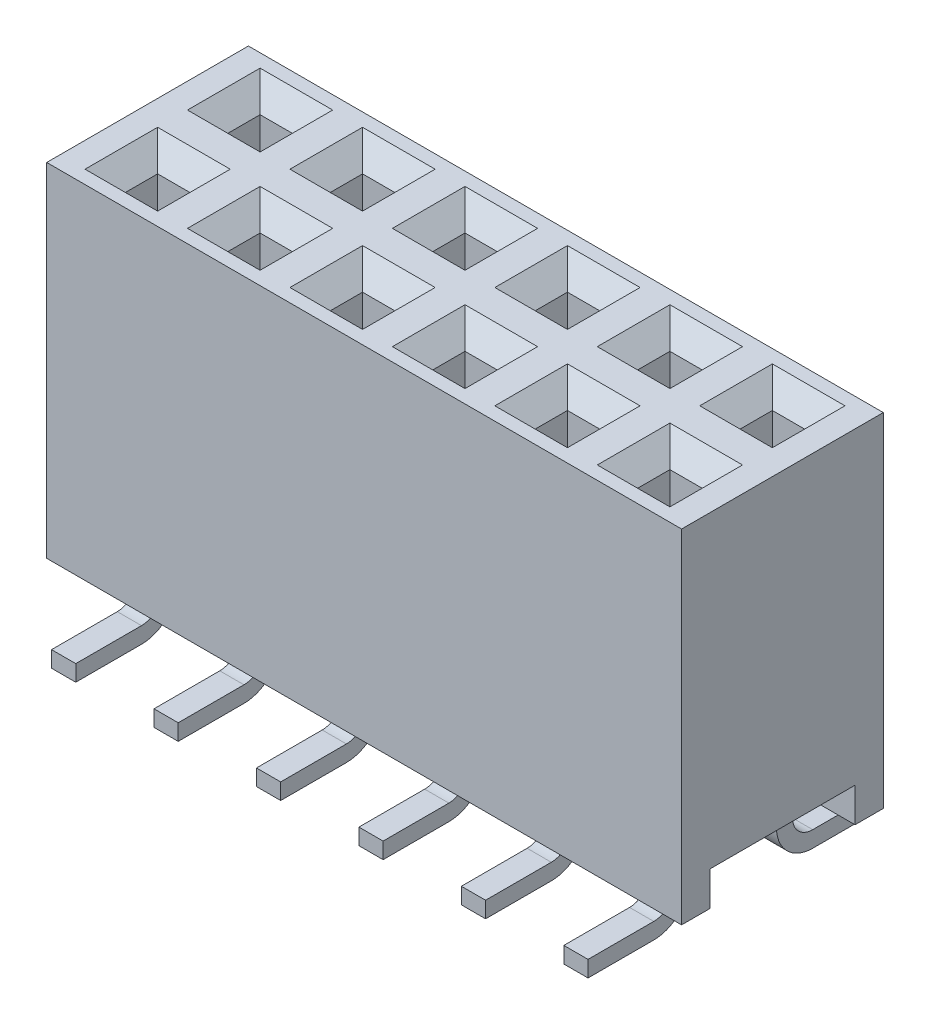
from build123d import *

# Parameters (mm, degrees)
EXTRUDE_1_DEPTH                    = 7.87
SKETCH_2_W                         = 0.8
SKETCH_2_H                         = 0.8
CUT_EXTRUDE_1_DEPTH                = 12.850607579
CHAMFER_1_SIZE                     = 0.5
PATTERN_LINEAR_1_COUNT             = 6
PATTERN_LINEAR_1_PITCH             = 2.54
PATTERN_LINEAR_1_COUNT_DIR2        = 2
PATTERN_LINEAR_1_PITCH_DIR2        = 2.54
CHAMFER_1_OF_PATTERN_LINEAR_1_SIZE = 0.5
EXTRUDE_2_DEPTH                    = 0.3
PATTERN_LINEAR_2_COUNT             = 6
PATTERN_LINEAR_2_PITCH             = 2.54


with BuildPart() as part:
    # Эскиз1 → Бобышка-Вытянуть1 (new, symmetric)
    with BuildSketch(Plane(origin=(0, 0, 0), x_dir=(0, 0, -1), z_dir=(1, 0, 0))):
        Polygon((-2.5, 1.2), (-2.5, 9.7), (2.5, 9.7), (2.5, 1.2), (1.8, 1.2), (1.8, 2.05), (-1.8, 2.05), (-1.8, 1.2), align=None)
    extrude(amount=EXTRUDE_1_DEPTH, both=True)

    # Эскиз2 → Вырез-Вытянуть1 (cut, through all)
    with BuildSketch(Plane(origin=(0, 9.7, 0), x_dir=(1, 0, 0), z_dir=(0, 1, 0))):
        with Locations((6.35, -1.27)):
            Rectangle(SKETCH_2_W, SKETCH_2_H)
    cut_extrude_1 = extrude(amount=-CUT_EXTRUDE_1_DEPTH, mode=Mode.SUBTRACT)

    # Фаска1
    chamfer_1_edges = [part.edges().sort_by_distance(p)[0] for p in [
        (6.75, 9.7, 1.27),
        (6.35, 9.7, 0.87),
        (5.95, 9.7, 1.27),
        (6.35, 9.7, 1.67),
    ]]
    chamfer(chamfer_1_edges, length=CHAMFER_1_SIZE)

    # Линейный массив1: Cut-Extrude 1 6 × 2
    with Locations(*[(-i * PATTERN_LINEAR_1_PITCH, 0, -j * PATTERN_LINEAR_1_PITCH_DIR2) for i in range(PATTERN_LINEAR_1_COUNT) for j in range(PATTERN_LINEAR_1_COUNT_DIR2) if (i, j) != (0, 0)]):
        add(cut_extrude_1, mode=Mode.SUBTRACT)

    # Фаска1 of Линейный массив1
    chamfer_1_of_pattern_linear_1_edges = [part.edges().sort_by_distance(p)[0] for p in [
        (6.75, 9.7, -1.27),
        (6.35, 9.7, -1.67),
        (5.95, 9.7, -1.27),
        (6.35, 9.7, -0.87),
        (4.21, 9.7, 1.27),
        (3.81, 9.7, 0.87),
        (3.41, 9.7, 1.27),
        (3.81, 9.7, 1.67),
        (4.21, 9.7, -1.27),
        (3.81, 9.7, -1.67),
        (3.41, 9.7, -1.27),
        (3.81, 9.7, -0.87),
        (1.67, 9.7, 1.27),
        (1.27, 9.7, 0.87),
        (0.87, 9.7, 1.27),
        (1.27, 9.7, 1.67),
        (1.67, 9.7, -1.27),
        (1.27, 9.7, -1.67),
        (0.87, 9.7, -1.27),
        (1.27, 9.7, -0.87),
        (-0.87, 9.7, 1.27),
        (-1.27, 9.7, 0.87),
        (-1.67, 9.7, 1.27),
        (-1.27, 9.7, 1.67),
        (-0.87, 9.7, -1.27),
        (-1.27, 9.7, -1.67),
        (-1.67, 9.7, -1.27),
        (-1.27, 9.7, -0.87),
        (-3.41, 9.7, 1.27),
        (-3.81, 9.7, 0.87),
        (-4.21, 9.7, 1.27),
        (-3.81, 9.7, 1.67),
        (-3.41, 9.7, -1.27),
        (-3.81, 9.7, -1.67),
        (-4.21, 9.7, -1.27),
        (-3.81, 9.7, -0.87),
        (-5.95, 9.7, 1.27),
        (-6.35, 9.7, 0.87),
        (-6.75, 9.7, 1.27),
        (-6.35, 9.7, 1.67),
        (-5.95, 9.7, -1.27),
        (-6.35, 9.7, -1.67),
        (-6.75, 9.7, -1.27),
        (-6.35, 9.7, -0.87),
    ]]
    chamfer(chamfer_1_of_pattern_linear_1_edges, length=CHAMFER_1_OF_PATTERN_LINEAR_1_SIZE)


with BuildPart() as body_2:
    # Эскиз3 → Бобышка-Вытянуть2 (new, symmetric)
    with BuildSketch(Plane(origin=(6.35, 0, 0), x_dir=(0, 0, -1), z_dir=(1, 0, 0))):
        with BuildLine():
            Line((-1.07, 0.9), (-1.07, 2.05))
            Line((-1.07, 2.05), (-1.47, 2.05))
            Line((-1.47, 2.05), (-1.47, 0.9))
            ThreePointArc((-1.47, 0.9), (-1.616446609, 0.546446609), (-1.97, 0.4))
            Line((-1.97, 0.4), (-3.6, 0.4))
            Line((-3.6, 0.4), (-3.6, 0))
            Line((-3.6, 0), (-1.97, 0))
            ThreePointArc((-1.97, 0), (-1.333603897, 0.263603897), (-1.07, 0.9))
        make_face()
    extrude(amount=EXTRUDE_2_DEPTH, both=True)


with BuildPart() as body_3:
    # Зеркальное отражение1: mirrored copy
    add(body_2.part.mirror(Plane.XY))


with BuildPart() as pattern_linear_2_1:
    # Линейный массив2: pattern copy
    add(body_3.part.moved(Location(Vector(-1, 0, 0) * (1 * PATTERN_LINEAR_2_PITCH))))


with BuildPart() as pattern_linear_2_2:
    # Линейный массив2: pattern copy
    add(body_3.part.moved(Location(Vector(-1, 0, 0) * (2 * PATTERN_LINEAR_2_PITCH))))


with BuildPart() as pattern_linear_2_3:
    # Линейный массив2: pattern copy
    add(body_3.part.moved(Location(Vector(-1, 0, 0) * (3 * PATTERN_LINEAR_2_PITCH))))


with BuildPart() as pattern_linear_2_4:
    # Линейный массив2: pattern copy
    add(body_3.part.moved(Location(Vector(-1, 0, 0) * (4 * PATTERN_LINEAR_2_PITCH))))


with BuildPart() as pattern_linear_2_5:
    # Линейный массив2: pattern copy
    add(body_3.part.moved(Location(Vector(-1, 0, 0) * (5 * PATTERN_LINEAR_2_PITCH))))


with BuildPart() as pattern_linear_2_6:
    # Линейный массив2: pattern copy
    add(body_2.part.moved(Location(Vector(-1, 0, 0) * (1 * PATTERN_LINEAR_2_PITCH))))


with BuildPart() as pattern_linear_2_7:
    # Линейный массив2: pattern copy
    add(body_2.part.moved(Location(Vector(-1, 0, 0) * (2 * PATTERN_LINEAR_2_PITCH))))


with BuildPart() as pattern_linear_2_8:
    # Линейный массив2: pattern copy
    add(body_2.part.moved(Location(Vector(-1, 0, 0) * (3 * PATTERN_LINEAR_2_PITCH))))


with BuildPart() as pattern_linear_2_9:
    # Линейный массив2: pattern copy
    add(body_2.part.moved(Location(Vector(-1, 0, 0) * (4 * PATTERN_LINEAR_2_PITCH))))


with BuildPart() as pattern_linear_2_10:
    # Линейный массив2: pattern copy
    add(body_2.part.moved(Location(Vector(-1, 0, 0) * (5 * PATTERN_LINEAR_2_PITCH))))


solid = Compound([part.part, body_2.part, body_3.part, pattern_linear_2_1.part, pattern_linear_2_2.part, pattern_linear_2_3.part, pattern_linear_2_4.part, pattern_linear_2_5.part, pattern_linear_2_6.part, pattern_linear_2_7.part, pattern_linear_2_8.part, pattern_linear_2_9.part, pattern_linear_2_10.part])
